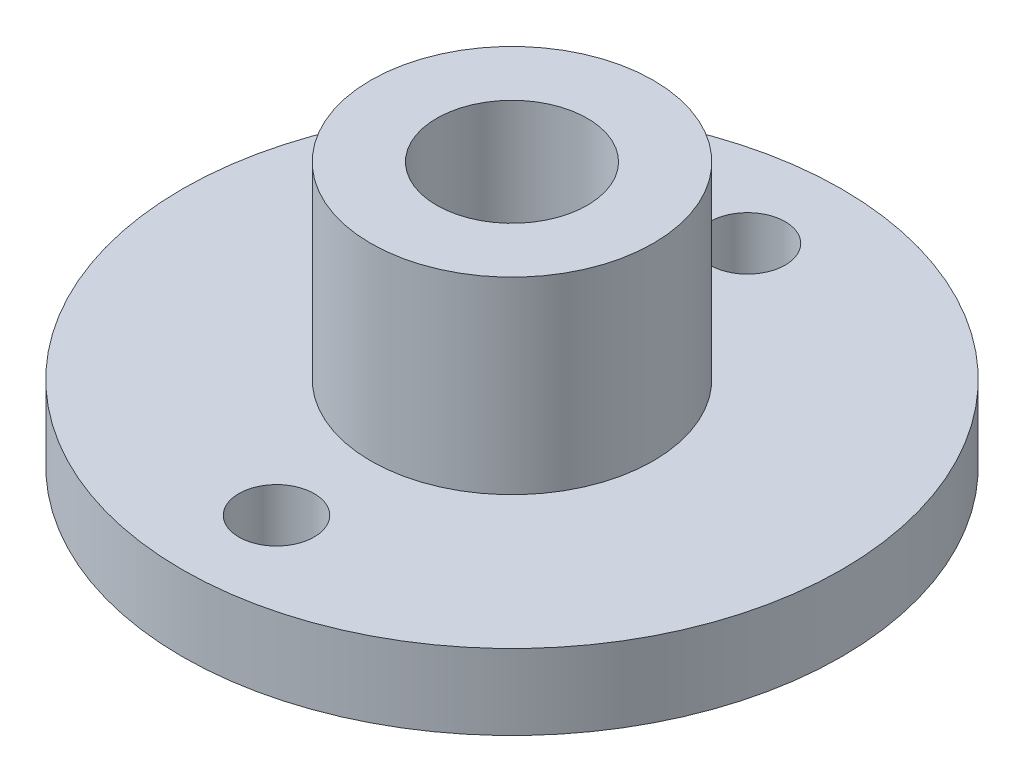
from build123d import *

# Parameters (mm, degrees)
SKETCH1_R           = 17.5
SKETCH1_R_2         = 2
BOSS_EXTRUDE1_DEPTH = 4
SKETCH2_R           = 7.5
SKETCH2_R_2         = 4
BOSS_EXTRUDE2_DEPTH = 10


with BuildPart() as part:
    # Sketch1 → Boss-Extrude1 (new body)
    with BuildSketch(Plane(origin=(0, 0, 0), x_dir=(1, 0, 0), z_dir=(0, 1, 0))):
        with Locations(Location((0, 0, 0), (0, 0, 270))):
            Circle(SKETCH1_R)
        with Locations(Location((0, 12.5, 0), (0, 0, 270))):
            Circle(SKETCH1_R_2, mode=Mode.SUBTRACT)
        with Locations(Location((0, -12.5, 0), (0, 0, 270))):
            Circle(SKETCH1_R_2, mode=Mode.SUBTRACT)
    extrude(amount=BOSS_EXTRUDE1_DEPTH)

    # Sketch2 → Boss-Extrude2 (add)
    with BuildSketch(Plane(origin=(0, 4, 0), x_dir=(1, 0, 0), z_dir=(0, 1, 0))):
        with Locations(Location((0, 0, 0), (0, 0, 270))):
            Circle(SKETCH2_R)
        with Locations(Location((0, 0, 0), (0, 0, 270))):
            Circle(SKETCH2_R_2, mode=Mode.SUBTRACT)
    extrude(amount=BOSS_EXTRUDE2_DEPTH)


solid = part.part
